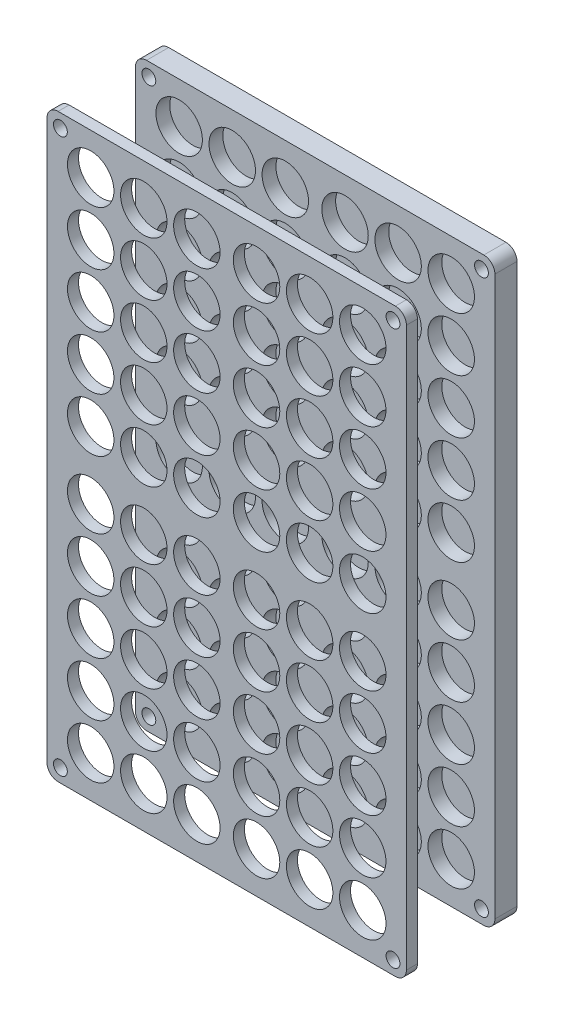
from build123d import *

# Parameters (mm, degrees)
SKETCH1_W                          = 210
SKETCH1_H                          = 130
F_120_X_200_X_67_TH_DEPTH          = 40
SKETCH2_R                          = 8.4
F_16_8_D_AND_52_D_TUBE_HOLES_DEPTH = 37
F_4_MM_R_FILET_R                   = 4
PLATE_SEPERATING_CUT_DEPTH         = 130.807549857
PLATE_SEPERATING_CUT_DEPTH_BACK    = 130.807549857
SKETCH3_W                          = 210
SKETCH3_H                          = 28
M4_THROUGH_HOLES_DEPTH             = 130.807549857
M4_THROUGH_HOLES_DEPTH_BACK        = 130.807549857
SKETCH2_3_R                        = 2.5


with BuildPart() as part:
    # Sketch1 → 120 x 200 x 67 th (new body)
    with BuildSketch(Plane(origin=(0, 0, 0), x_dir=(0, 1, 0), z_dir=(0, 0, 1))):
        Rectangle(SKETCH1_W, SKETCH1_H)
    extrude(amount=F_120_X_200_X_67_TH_DEPTH)

    # Sketch2 → 16.8 D and 52 D tube holes (cut)
    with BuildSketch(Plane.XY.offset(40)):
        with Locations((-49.2, -12.141617153)):
            Circle(SKETCH2_R)
        with Locations((-30, -12.141617153)):
            Circle(SKETCH2_R)
        with Locations((-10.8, -12.141617153)):
            Circle(SKETCH2_R)
        with Locations((10.8, -12.141617153)):
            Circle(SKETCH2_R)
        with Locations((30, -12.141617153)):
            Circle(SKETCH2_R)
        with Locations((49.2, -12.141617153)):
            Circle(SKETCH2_R)
        with Locations((10.8, -31.641617153)):
            Circle(SKETCH2_R)
        with Locations((30, -31.641617153)):
            Circle(SKETCH2_R)
        with Locations((49.2, -31.641617153)):
            Circle(SKETCH2_R)
        with Locations((-10.8, -31.641617153)):
            Circle(SKETCH2_R)
        with Locations((-30, -31.641617153)):
            Circle(SKETCH2_R)
        with Locations((-49.2, -31.641617153)):
            Circle(SKETCH2_R)
        with Locations((10.8, -51.141617153)):
            Circle(SKETCH2_R)
        with Locations((30, -51.141617153)):
            Circle(SKETCH2_R)
        with Locations((49.2, -51.141617153)):
            Circle(SKETCH2_R)
        with Locations((-10.8, -51.141617153)):
            Circle(SKETCH2_R)
        with Locations((-30, -51.141617153)):
            Circle(SKETCH2_R)
        with Locations((-49.2, -51.141617153)):
            Circle(SKETCH2_R)
        with Locations((10.8, -70.641617153)):
            Circle(SKETCH2_R)
        with Locations((30, -70.641617153)):
            Circle(SKETCH2_R)
        with Locations((49.2, -70.641617153)):
            Circle(SKETCH2_R)
        with Locations((-10.8, -70.641617153)):
            Circle(SKETCH2_R)
        with Locations((-30, -70.641617153)):
            Circle(SKETCH2_R)
        with Locations((-49.2, -70.641617153)):
            Circle(SKETCH2_R)
        with Locations((10.8, -90.141617153)):
            Circle(SKETCH2_R)
        with Locations((30, -90.141617153)):
            Circle(SKETCH2_R)
        with Locations((49.2, -90.141617153)):
            Circle(SKETCH2_R)
        with Locations((-10.8, -90.141617153)):
            Circle(SKETCH2_R)
        with Locations((-30, -90.141617153)):
            Circle(SKETCH2_R)
        with Locations((-49.2, -90.141617153)):
            Circle(SKETCH2_R)
        with Locations((-49.2, 90.141617153)):
            Circle(SKETCH2_R)
        with Locations((-30, 90.141617153)):
            Circle(SKETCH2_R)
        with Locations((-10.8, 90.141617153)):
            Circle(SKETCH2_R)
        with Locations((49.2, 90.141617153)):
            Circle(SKETCH2_R)
        with Locations((30, 90.141617153)):
            Circle(SKETCH2_R)
        with Locations((10.8, 90.141617153)):
            Circle(SKETCH2_R)
        with Locations((-49.2, 70.641617153)):
            Circle(SKETCH2_R)
        with Locations((-30, 70.641617153)):
            Circle(SKETCH2_R)
        with Locations((-10.8, 70.641617153)):
            Circle(SKETCH2_R)
        with Locations((49.2, 70.641617153)):
            Circle(SKETCH2_R)
        with Locations((30, 70.641617153)):
            Circle(SKETCH2_R)
        with Locations((10.8, 70.641617153)):
            Circle(SKETCH2_R)
        with Locations((-49.2, 51.141617153)):
            Circle(SKETCH2_R)
        with Locations((-30, 51.141617153)):
            Circle(SKETCH2_R)
        with Locations((-10.8, 51.141617153)):
            Circle(SKETCH2_R)
        with Locations((49.2, 51.141617153)):
            Circle(SKETCH2_R)
        with Locations((30, 51.141617153)):
            Circle(SKETCH2_R)
        with Locations((10.8, 51.141617153)):
            Circle(SKETCH2_R)
        with Locations((-49.2, 31.641617153)):
            Circle(SKETCH2_R)
        with Locations((-30, 31.641617153)):
            Circle(SKETCH2_R)
        with Locations((-10.8, 31.641617153)):
            Circle(SKETCH2_R)
        with Locations((49.2, 31.641617153)):
            Circle(SKETCH2_R)
        with Locations((30, 31.641617153)):
            Circle(SKETCH2_R)
        with Locations((10.8, 31.641617153)):
            Circle(SKETCH2_R)
        with Locations((30, 12.141617153)):
            Circle(SKETCH2_R)
        with Locations((10.8, 12.141617153)):
            Circle(SKETCH2_R)
        with Locations((-10.8, 12.141617153)):
            Circle(SKETCH2_R)
        with Locations((-30, 12.141617153)):
            Circle(SKETCH2_R)
        with Locations((-49.2, 12.141617153)):
            Circle(SKETCH2_R)
        with Locations((49.2, 12.141617153)):
            Circle(SKETCH2_R)
    extrude(amount=-F_16_8_D_AND_52_D_TUBE_HOLES_DEPTH, mode=Mode.SUBTRACT)

    # 4 mm R filet
    f_4_mm_r_filet_edges = [part.edges().sort_by_distance(p)[0] for p in [
        (-65, 105, 20),
        (65, 105, 20),
        (-65, -105, 20),
        (65, -105, 20),
    ]]
    fillet(f_4_mm_r_filet_edges, radius=F_4_MM_R_FILET_R)

    # Sketch3 → Plate Seperating cut (cut, two sides: drawn at the far end of the back side and taken through both)
    with BuildSketch(Plane.YZ.offset(-PLATE_SEPERATING_CUT_DEPTH_BACK)):
        with Locations((0, 22)):
            Rectangle(SKETCH3_W, SKETCH3_H)
    extrude(amount=PLATE_SEPERATING_CUT_DEPTH + PLATE_SEPERATING_CUT_DEPTH_BACK, mode=Mode.SUBTRACT)


with BuildPart() as plate_seperating_cut_piece_1:
    # of the separate pieces the step leaves, piece 1, a body of its own (plate_seperating_cut_pieces)
    add(part.part.solids().sort_by_distance((65, -101, 0))[0])


with BuildPart() as plate_seperating_cut_piece_2:
    # of the separate pieces the step leaves, piece 2, a body of its own (plate_seperating_cut_pieces)
    add(part.part.solids().sort_by_distance((65, 101, 36))[0])


with BuildPart() as m4_through_holes_tool:
    # Sketch2<3> → M4 through holes (new, two sides: drawn at the far end of the back side and taken through both)
    with BuildSketch(Plane.XY.offset(40).offset(-M4_THROUGH_HOLES_DEPTH_BACK)):
        with Locations((-60.158155916, -100.158155916)):
            Circle(SKETCH2_3_R)
        with Locations((-60.158155916, 100.158155916)):
            Circle(SKETCH2_3_R)
        with Locations((60.158155916, -100.158155916)):
            Circle(SKETCH2_3_R)
        with Locations((60.158155916, 100.158155916)):
            Circle(SKETCH2_3_R)
    extrude(amount=M4_THROUGH_HOLES_DEPTH + M4_THROUGH_HOLES_DEPTH_BACK)


with BuildPart() as plate_seperating_cut_piece_1_1:
    add(plate_seperating_cut_piece_1.part)

    # M4 through holes: cut by m4_through_holes_tool
    add(m4_through_holes_tool.part, mode=Mode.SUBTRACT)


with BuildPart() as plate_seperating_cut_piece_2_1:
    add(plate_seperating_cut_piece_2.part)

    # M4 through holes: cut by m4_through_holes_tool
    add(m4_through_holes_tool.part, mode=Mode.SUBTRACT)


solid = Compound([plate_seperating_cut_piece_1_1.part, plate_seperating_cut_piece_2_1.part])
